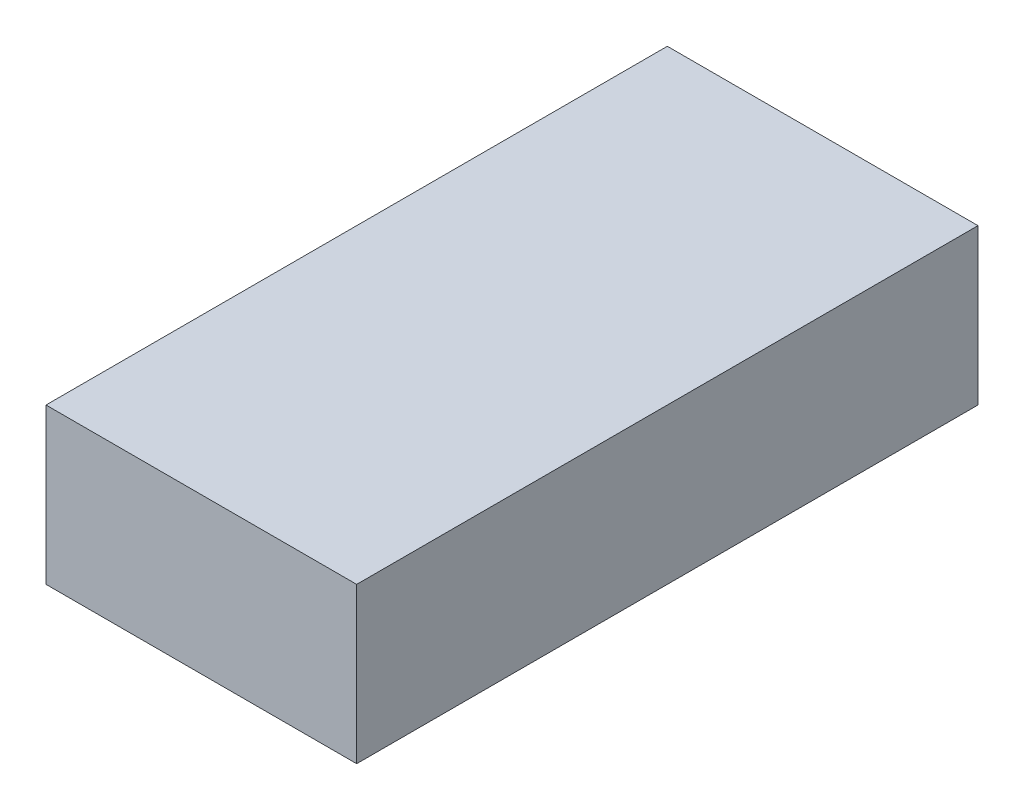
from build123d import *

# Parameters (mm, degrees)
SKETCH1_W           = 12.7
SKETCH1_H           = 6.35
BOSS_EXTRUDE1_DEPTH = 25.4


with BuildPart() as part:
    # Sketch1 → Boss-Extrude1 (new body)
    with BuildSketch(Plane.XY):
        with Locations((-6.35, 3.175)):
            Rectangle(SKETCH1_W, SKETCH1_H)
    extrude(amount=BOSS_EXTRUDE1_DEPTH)


solid = part.part
